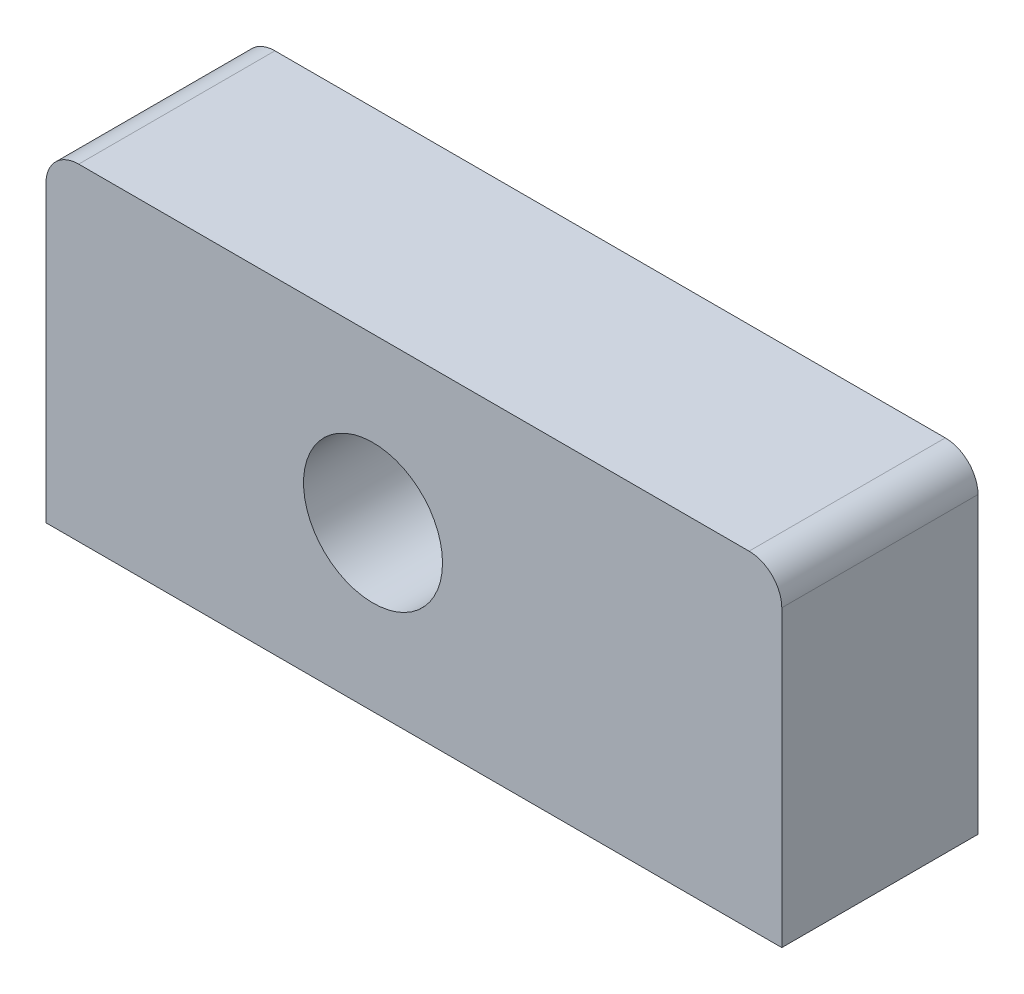
from build123d import *

# Parameters (mm, degrees)
SKETCH1_W           = 45
SKETCH1_H           = 20
SKETCH1_R           = 4.25
BOSS_EXTRUDE1_DEPTH = 12
FILLET1_R           = 2
SKETCH2_R           = 1.5
CUT_EXTRUDE1_DEPTH  = 5


with BuildPart() as part:
    # Sketch1 → Boss-Extrude1 (new body)
    with BuildSketch(Plane.XY):
        with Locations((22.5, 10)):
            Rectangle(SKETCH1_W, SKETCH1_H)
        with Locations((20, 10)):
            Circle(SKETCH1_R, mode=Mode.SUBTRACT)
    extrude(amount=BOSS_EXTRUDE1_DEPTH)

    # Fillet1
    fillet1_edges = [part.edges().sort_by_distance(p)[0] for p in [
        (0, 20, 6),
        (45, 20, 6),
    ]]
    fillet(fillet1_edges, radius=FILLET1_R)

    # Sketch2 → Cut-Extrude1 (cut)
    with BuildSketch(Plane.XZ):
        with Locations(Location((5, 6, 0), (0, 0, 270))):
            Circle(SKETCH2_R)
        with Locations(Location((35, 6, 0), (0, 0, 270))):
            Circle(SKETCH2_R)
    extrude(amount=-CUT_EXTRUDE1_DEPTH, mode=Mode.SUBTRACT)


solid = part.part
